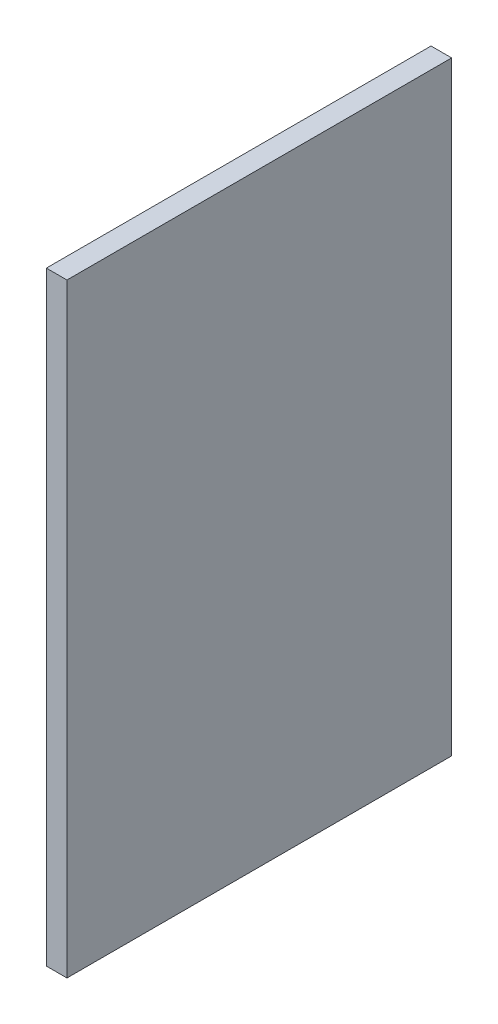
from build123d import *

# Parameters (mm, degrees)
SKETCH1_W           = 355.6
SKETCH1_H           = 558.8
BOSS_EXTRUDE1_DEPTH = 19.05


with BuildPart() as part:
    # Sketch1 → Boss-Extrude1 (new body)
    with BuildSketch(Plane(origin=(0, 0, 0), x_dir=(0, 0, -1), z_dir=(1, 0, 0))):
        Rectangle(SKETCH1_W, SKETCH1_H)
    extrude(amount=BOSS_EXTRUDE1_DEPTH)


solid = part.part
